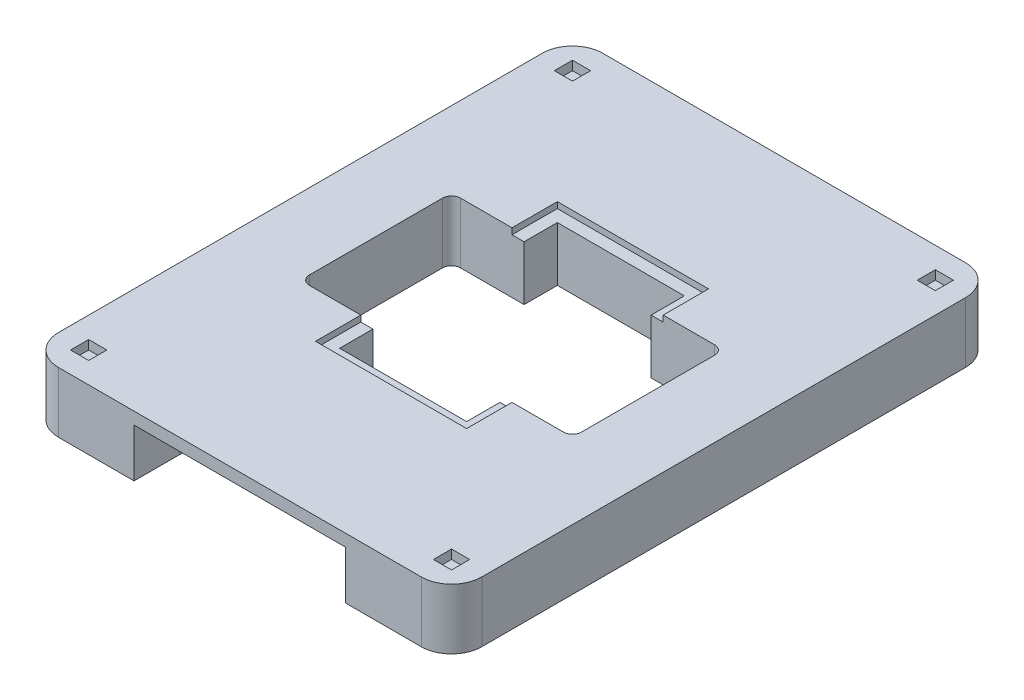
from build123d import *

# Parameters (mm, degrees)
SKETCH_1_W                                 = 200
SKETCH_1_H                                 = 200
EXTRUDE_1_DEPTH                            = 20
SKETCH_2_W                                 = 200
SKETCH_2_H                                 = 200
SKETCH_2_W_2                               = 140
SKETCH_2_H_2                               = 180
CUT_EXTRUDE_2_DEPTH                        = 143.828568571
FILLET_1_R                                 = 10
FILLET_2_R                                 = 10
FILLET_3_R                                 = 10
FILLET_4_R                                 = 10
CUT_EXTRUDE_4_DEPTH                        = 5
MIRROR_3_AT_THE_SECOND_PLANE_COPY_1_DEPTH  = 5
SKETCH_5_R                                 = 5
CUT_EXTRUDE_5_DEPTH                        = 6.2
CUT_EXTRUDE_7_DEPTH                        = 16
SKETCH_8_R                                 = 4.1
CUT_EXTRUDE_8_DEPTH                        = 4
DRAFT_2_ANGLE                              = 10
DRAFT_2_OF_MIRROR_10_2_ANGLE               = 10
DRAFT_2_OF_MIRROR_11_2_ANGLE               = 10
SKETCH_14_W                                = 6
SKETCH_14_H                                = 6
CUT_EXTRUDE_9_DEPTH                        = 3
MIRROR_12_AT_THE_SECOND_PLANE_COPY_1_SKE_W = 6
MIRROR_12_AT_THE_SECOND_PLANE_COPY_1_SKE_H = 6
MIRROR_12_AT_THE_SECOND_PLANE_COPY_1_DEPTH = 3
SKETCH_15_W                                = 50
SKETCH_15_H                                = 80
CUT_EXTRUDE_10_DEPTH                       = 2
SKETCH_16_W                                = 42
SKETCH_16_H                                = 72
CUT_EXTRUDE_11_DEPTH                       = 116.429632244
CUT_EXTRUDE_12_DEPTH                       = 116.758369028


with BuildPart() as part:
    # 草图1 → 凸台-拉伸1 (new body)
    with BuildSketch(Plane(origin=(0, 0, 0), x_dir=(1, 0, 0), z_dir=(0, 1, 0))):
        Rectangle(SKETCH_1_W, SKETCH_1_H)
    extrude(amount=EXTRUDE_1_DEPTH)

    # 草图2 → 切除-拉伸2 (cut, through all)
    with BuildSketch(Plane(origin=(0, 20, 0), x_dir=(1, 0, 0), z_dir=(0, 1, 0))):
        Rectangle(SKETCH_2_W, SKETCH_2_H)
        Rectangle(SKETCH_2_W_2, SKETCH_2_H_2, mode=Mode.SUBTRACT)
    extrude(amount=-CUT_EXTRUDE_2_DEPTH, mode=Mode.SUBTRACT)

    # 圆角1
    fillet_1_edges = [part.edges().sort_by_distance(p)[0] for p in [
        (-70, 10, -90),
    ]]
    fillet(fillet_1_edges, radius=FILLET_1_R)

    # 圆角2
    fillet_2_edges = [part.edges().sort_by_distance(p)[0] for p in [
        (70, 10, -90),
    ]]
    fillet(fillet_2_edges, radius=FILLET_2_R)

    # 圆角3
    fillet_3_edges = [part.edges().sort_by_distance(p)[0] for p in [
        (70, 10, 90),
    ]]
    fillet(fillet_3_edges, radius=FILLET_3_R)

    # 圆角4
    fillet_4_edges = [part.edges().sort_by_distance(p)[0] for p in [
        (-70, 10, 90),
    ]]
    fillet(fillet_4_edges, radius=FILLET_4_R)

    # 草图4 → 切除-拉伸4 (cut)
    with BuildSketch(Plane.XZ):
        with BuildLine():
            Line((-59.5, 84.974937186), (-59.5, 86))
            Line((-59.5, 86), (-60.5, 86))
            Line((-60.5, 86), (-60.5, 84.974937186))
            ThreePointArc((-60.5, 84.974937186), (-63.535533906, 83.535533906), (-64.974937186, 80.5))
            Line((-64.974937186, 80.5), (-66, 80.5))
            Line((-66, 80.5), (-66, 79.5))
            Line((-66, 79.5), (-64.974937186, 79.5))
            ThreePointArc((-64.974937186, 79.5), (-63.535533906, 76.464466094), (-60.5, 75.025062814))
            Line((-60.5, 75.025062814), (-60.5, 74))
            Line((-60.5, 74), (-59.5, 74))
            Line((-59.5, 74), (-59.5, 75.025062814))
            ThreePointArc((-59.5, 75.025062814), (-56.464466094, 76.464466094), (-55.025062814, 79.5))
            Line((-55.025062814, 79.5), (-54, 79.5))
            Line((-54, 79.5), (-54, 80.5))
            Line((-54, 80.5), (-55.025062814, 80.5))
            ThreePointArc((-55.025062814, 80.5), (-56.464466094, 83.535533906), (-59.5, 84.974937186))
        make_face()
    cut_extrude_4 = extrude(amount=-CUT_EXTRUDE_4_DEPTH, mode=Mode.SUBTRACT)

    # 镜向3: 切除-拉伸4 across plane
    add(cut_extrude_4.mirror(Plane(origin=(0, 0, 0), x_dir=(0, 0, 1), z_dir=(1, 0, 0))), mode=Mode.SUBTRACT)

    # 镜向3 at the second plane: 切除-拉伸4 across plane
    add(cut_extrude_4.mirror(Plane.XY), mode=Mode.SUBTRACT)

    # 镜向3 at the second plane copy 1 sket → 镜向3 at the second plane copy 1 (cut)
    with BuildSketch(Plane(origin=(0, 0, 0), x_dir=(-1, 0, 0), z_dir=(0, -1, 0))):
        with BuildLine():
            Line((-59.5, 84.974937186), (-59.5, 86))
            Line((-59.5, 86), (-60.5, 86))
            Line((-60.5, 86), (-60.5, 84.974937186))
            ThreePointArc((-60.5, 84.974937186), (-63.535533906, 83.535533906), (-64.974937186, 80.5))
            Line((-64.974937186, 80.5), (-66, 80.5))
            Line((-66, 80.5), (-66, 79.5))
            Line((-66, 79.5), (-64.974937186, 79.5))
            ThreePointArc((-64.974937186, 79.5), (-63.535533906, 76.464466094), (-60.5, 75.025062814))
            Line((-60.5, 75.025062814), (-60.5, 74))
            Line((-60.5, 74), (-59.5, 74))
            Line((-59.5, 74), (-59.5, 75.025062814))
            ThreePointArc((-59.5, 75.025062814), (-56.464466094, 76.464466094), (-55.025062814, 79.5))
            Line((-55.025062814, 79.5), (-54, 79.5))
            Line((-54, 79.5), (-54, 80.5))
            Line((-54, 80.5), (-55.025062814, 80.5))
            ThreePointArc((-55.025062814, 80.5), (-56.464466094, 83.535533906), (-59.5, 84.974937186))
        make_face()
    extrude(amount=-MIRROR_3_AT_THE_SECOND_PLANE_COPY_1_DEPTH, mode=Mode.SUBTRACT)

    # 草图5 → 切除-拉伸5 (cut)
    with BuildSketch(Plane.XZ):
        with Locations(Location((-60, 80, 0), (0, 0, 270))):
            Circle(SKETCH_5_R)
    extrude(amount=-CUT_EXTRUDE_5_DEPTH, mode=Mode.SUBTRACT)

    # 草图7 → 切除-拉伸7 (cut)
    with BuildSketch(Plane.XZ):
        with BuildLine():
            Line((35, 110), (-35, 110))
            Line((-35, 110), (-35, 75))
            ThreePointArc((-35, 75), (-33.535533906, 71.464466094), (-30, 70))
            Line((-30, 70), (30, 70))
            ThreePointArc((30, 70), (33.535533906, 71.464466094), (35, 75))
            Line((35, 75), (35, 110))
        make_face()
    cut_extrude_7 = extrude(amount=-CUT_EXTRUDE_7_DEPTH, mode=Mode.SUBTRACT)

    # 镜向6: 切除-拉伸7 across plane
    add(cut_extrude_7.mirror(Plane.XY), mode=Mode.SUBTRACT)

    # 草图8 → 切除-拉伸8 (cut)
    with BuildSketch(Plane.XZ):
        with Locations(Location((-40.5, 40.5, 0), (0, 0, 270))):
            Circle(SKETCH_8_R)
    cut_extrude_8 = extrude(amount=-CUT_EXTRUDE_8_DEPTH, mode=Mode.SUBTRACT)

    # 拔模2
    draft_2_faces = [part.faces().sort_by_distance(p)[0] for p in [
        (-40.5, 2, 44.6),
    ]]
    draft(draft_2_faces, Plane(origin=(-40.5, 4, 40.5), x_dir=(0, 0, -1), z_dir=(0, -1, 0)), DRAFT_2_ANGLE)

    # 镜向10: 切除-拉伸8 across plane
    add(cut_extrude_8.mirror(Plane(origin=(0, 0, 0), x_dir=(0, 0, 1), z_dir=(1, 0, 0))), mode=Mode.SUBTRACT)

    # 拔模2 of Mirror 10 2
    draft_2_of_mirror_10_2_faces = [part.faces().sort_by_distance(p)[0] for p in [
        (40.5, 2, 44.6),
    ]]
    draft(draft_2_of_mirror_10_2_faces, Plane(origin=(40.5, 4, 40.5), x_dir=(0, 0, -1), z_dir=(0, -1, 0)), DRAFT_2_OF_MIRROR_10_2_ANGLE)

    # 镜向11: 切除-拉伸8 across plane
    add(cut_extrude_8.mirror(Plane.XY), mode=Mode.SUBTRACT)

    # 拔模2 of Mirror 11 2
    draft_2_of_mirror_11_2_faces = [part.faces().sort_by_distance(p)[0] for p in [
        (-40.5, 2, -44.6),
    ]]
    draft(draft_2_of_mirror_11_2_faces, Plane(origin=(-40.5, 4, -40.5), x_dir=(0, 0, 1), z_dir=(0, -1, 0)), DRAFT_2_OF_MIRROR_11_2_ANGLE)

    # 草图14 → 切除-拉伸9 (cut)
    with BuildSketch(Plane(origin=(0, 20, 0), x_dir=(1, 0, 0), z_dir=(0, 1, 0))):
        with Locations((-60, 80)):
            Rectangle(SKETCH_14_W, SKETCH_14_H)
    cut_extrude_9 = extrude(amount=-CUT_EXTRUDE_9_DEPTH, mode=Mode.SUBTRACT)

    # 镜向12: 切除-拉伸9 across plane
    add(cut_extrude_9.mirror(Plane(origin=(0, 0, 0), x_dir=(0, 0, 1), z_dir=(1, 0, 0))), mode=Mode.SUBTRACT)

    # 镜向12 at the second plane: 切除-拉伸9 across plane
    add(cut_extrude_9.mirror(Plane.XY), mode=Mode.SUBTRACT)

    # 镜向12 at the second plane copy 1 ske → 镜向12 at the second plane copy 1 (cut)
    with BuildSketch(Plane(origin=(0, 20, 0), x_dir=(-1, 0, 0), z_dir=(0, 1, 0))):
        with Locations((-60, 80)):
            Rectangle(MIRROR_12_AT_THE_SECOND_PLANE_COPY_1_SKE_W, MIRROR_12_AT_THE_SECOND_PLANE_COPY_1_SKE_H)
    extrude(amount=-MIRROR_12_AT_THE_SECOND_PLANE_COPY_1_DEPTH, mode=Mode.SUBTRACT)

    # 草图15 → 切除-拉伸10 (cut)
    with BuildSketch(Plane(origin=(0, 20, 0), x_dir=(1, 0, 0), z_dir=(0, 1, 0))):
        Rectangle(SKETCH_15_W, SKETCH_15_H)
    extrude(amount=-CUT_EXTRUDE_10_DEPTH, mode=Mode.SUBTRACT)

    # 草图16 → 切除-拉伸11 (cut, through all)
    with BuildSketch(Plane(origin=(0, 18, 0), x_dir=(1, 0, 0), z_dir=(0, 1, 0))):
        Rectangle(SKETCH_16_W, SKETCH_16_H)
    extrude(amount=-CUT_EXTRUDE_11_DEPTH, mode=Mode.SUBTRACT)

    # 草图17 → 切除-拉伸12 (cut, through all)
    with BuildSketch(Plane(origin=(0, 20, 0), x_dir=(1, 0, 0), z_dir=(0, 1, 0))):
        with BuildLine():
            Line((42, -25), (-42, -25))
            ThreePointArc((-42, -25), (-44.121320344, -24.121320344), (-45, -22))
            Line((-45, -22), (-45, 22))
            ThreePointArc((-45, 22), (-44.121320344, 24.121320344), (-42, 25))
            Line((-42, 25), (42, 25))
            ThreePointArc((42, 25), (44.121320344, 24.121320344), (45, 22))
            Line((45, 22), (45, -22))
            ThreePointArc((45, -22), (44.121320344, -24.121320344), (42, -25))
        make_face()
    extrude(amount=-CUT_EXTRUDE_12_DEPTH, mode=Mode.SUBTRACT)


solid = part.part
